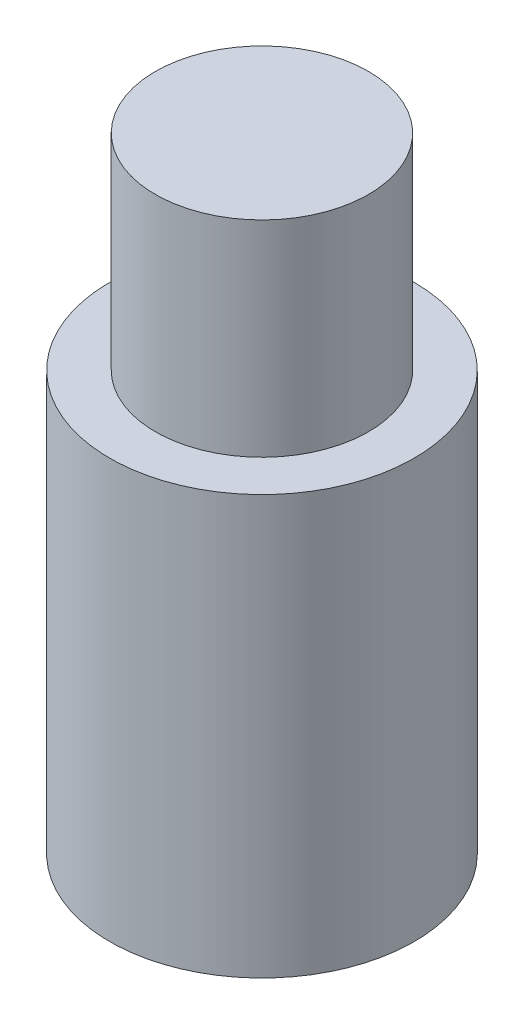
from build123d import *

# Parameters (mm, degrees)
ESBO_O1_R                = 2.8
RESSALTO_EXTRUS_O1_DEPTH = 5.4
ESBO_O2_R                = 4
RESSALTO_EXTRUS_O2_DEPTH = 11


with BuildPart() as part:
    # Esboço1 → Ressalto-extrusão1 (new body)
    with BuildSketch(Plane(origin=(0, 0, 0), x_dir=(1, 0, 0), z_dir=(0, 1, 0))):
        with Locations(Location((0, 0, 0), (0, 0, 90))):
            Circle(ESBO_O1_R)
    extrude(amount=RESSALTO_EXTRUS_O1_DEPTH)

    # Esboço2 → Ressalto-extrusão2 (add)
    with BuildSketch(Plane.XZ):
        with Locations(Location((0, 0, 0), (0, 0, 270))):
            Circle(ESBO_O2_R)
    extrude(amount=RESSALTO_EXTRUS_O2_DEPTH)


solid = part.part
